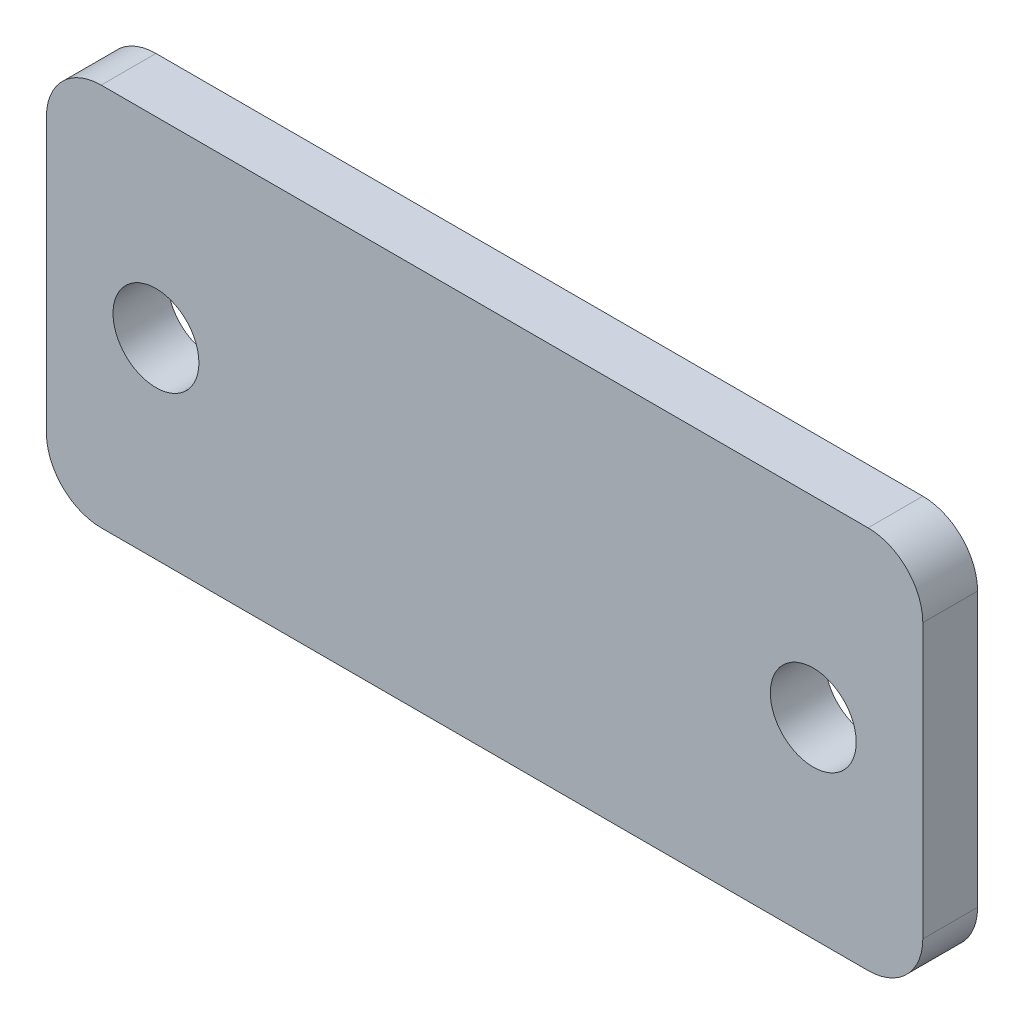
from build123d import *

# Parameters (mm, degrees)
SKETCH1_W           = 50.8
SKETCH1_H           = 22.225
SKETCH1_R           = 2.4892
BOSS_EXTRUDE1_DEPTH = 3.175
FILLET1_R           = 3.175


with BuildPart() as part:
    # Sketch1 → Boss-Extrude1 (new body)
    with BuildSketch(Plane.XY):
        Rectangle(SKETCH1_W, SKETCH1_H)
        with Locations((-19.05, 0)):
            Circle(SKETCH1_R, mode=Mode.SUBTRACT)
        with Locations((19.05, 0)):
            Circle(SKETCH1_R, mode=Mode.SUBTRACT)
    extrude(amount=BOSS_EXTRUDE1_DEPTH)

    # Fillet1
    fillet1_edges = [part.edges().sort_by_distance(p)[0] for p in [
        (-25.4, 11.1125, 1.5875),
        (25.4, 11.1125, 1.5875),
        (25.4, -11.1125, 1.5875),
        (-25.4, -11.1125, 1.5875),
    ]]
    fillet(fillet1_edges, radius=FILLET1_R)


solid = part.part
